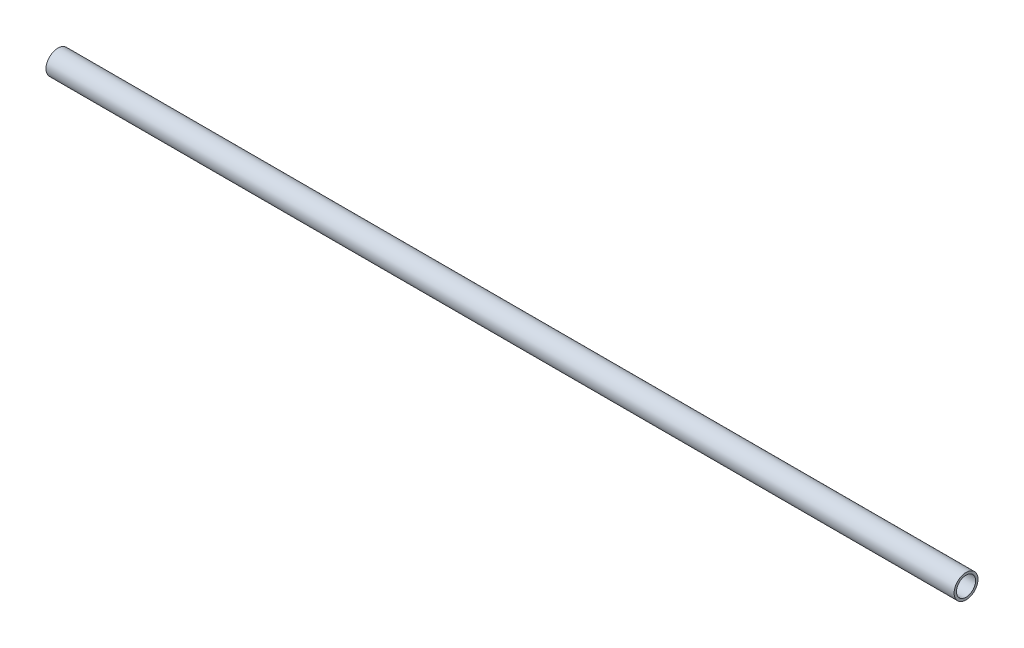
from build123d import *

# Parameters (mm, degrees)
SKETCH1_R           = 2.5
SKETCH1_R_2         = 2
BOSS_EXTRUDE1_DEPTH = 95


with BuildPart() as part:
    # Sketch1 → Boss-Extrude1 (new, symmetric)
    with BuildSketch(Plane(origin=(0, 0, 0), x_dir=(0, 0, -1), z_dir=(1, 0, 0))):
        Circle(SKETCH1_R)
        Circle(SKETCH1_R_2, mode=Mode.SUBTRACT)
    extrude(amount=BOSS_EXTRUDE1_DEPTH, both=True)


solid = part.part
